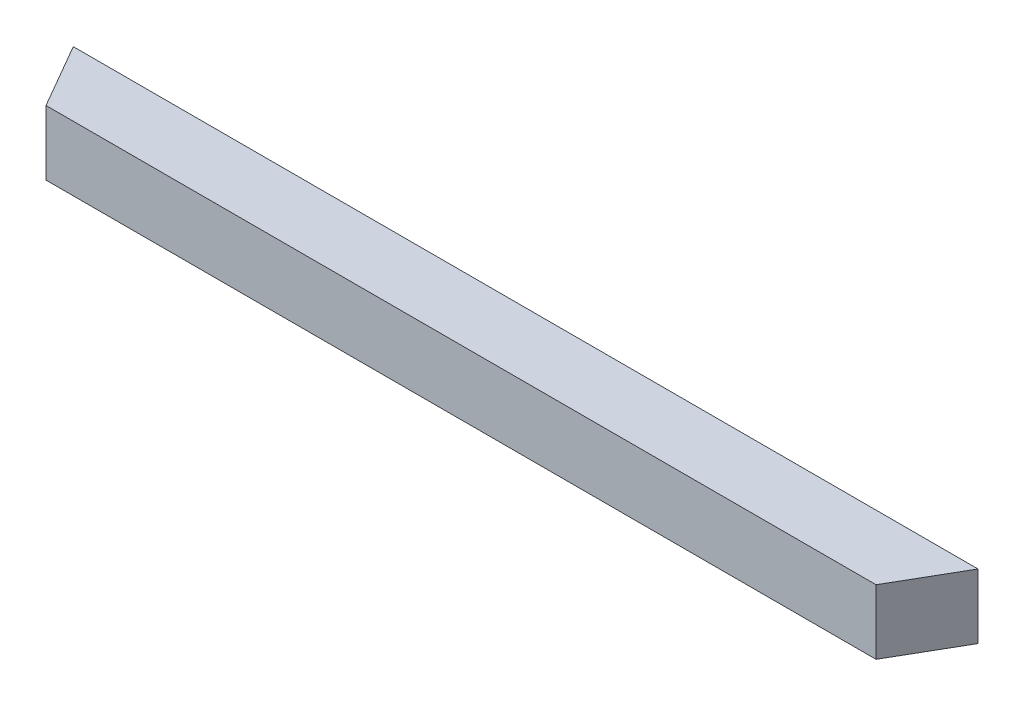
from build123d import *

# Parameters (mm, degrees)
BOSS_EXTRUDE1_DEPTH = 20


with BuildPart() as part:
    # Sketch2 → Boss-Extrude1 (new body)
    with BuildSketch(Plane(origin=(0, 0, 0), x_dir=(1, 0, 0), z_dir=(0, 1, 0))):
        Polygon((-140, 0), (140, 0), (128.452994616, -20), (-128.452994616, -20), align=None)
    extrude(amount=BOSS_EXTRUDE1_DEPTH)


solid = part.part
